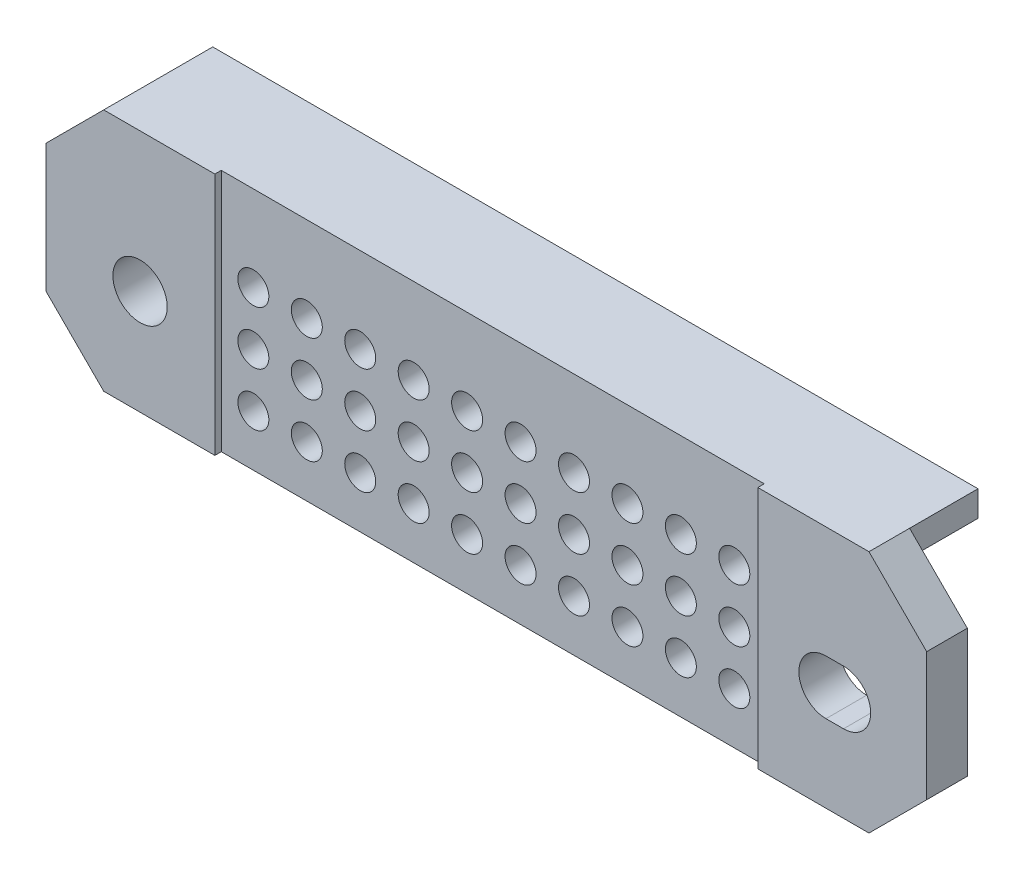
from build123d import *

# Parameters (mm, degrees)
BOSS_EXTRUDE1_DEPTH = 2.032
BOSS_EXTRUDE2_DEPTH = 0.381
SKETCH3_W           = 45.466
SKETCH3_H           = 1.524
BOSS_EXTRUDE3_DEPTH = 4.064
SKETCH4_R           = 1.6129
SKETCH4_R_2         = 0.92075
CUT_EXTRUDE1_DEPTH  = 55.441983395


with BuildPart() as part:
    # Sketch1 → Boss-Extrude1 (new body)
    with BuildSketch(Plane.XY):
        Polygon((0, 3.429), (0, 11.049), (3.429, 14.478), (48.895, 14.478), (52.324, 11.049), (52.324, 3.429), (48.895, 0), (3.429, 0), align=None)
    extrude(amount=BOSS_EXTRUDE1_DEPTH)

    # Sketch2 → Boss-Extrude2 (add)
    with BuildSketch(Plane.XY.offset(2.032)):
        Polygon((0, 11.049), (0, 3.429), (3.429, 0), (10.033, 0), (10.033, 14.478), (3.429, 14.478), align=None)
        Polygon((42.291, 14.478), (42.291, 0), (48.895, 0), (52.324, 3.429), (52.324, 11.049), (48.895, 14.478), align=None)
    extrude(amount=BOSS_EXTRUDE2_DEPTH)

    # Sketch3 → Boss-Extrude3 (add)
    with BuildSketch(Plane(origin=(0, 0, 0), x_dir=(-1, 0, 0), z_dir=(0, 0, -1))):
        with Locations((-26.162, 13.716)):
            Rectangle(SKETCH3_W, SKETCH3_H)
    extrude(amount=BOSS_EXTRUDE3_DEPTH)

    # Sketch4 → Cut-Extrude1 (cut, through all)
    with BuildSketch(Plane(origin=(0, 0, 0), x_dir=(-1, 0, 0), z_dir=(0, 0, -1))):
        with Locations((-5.588, 6.223)):
            Circle(SKETCH4_R)
        with Locations((-11.938, 3.048)):
            Circle(SKETCH4_R_2)
        with Locations((-15.113, 3.048)):
            Circle(SKETCH4_R_2)
        with Locations((-18.288, 3.048)):
            Circle(SKETCH4_R_2)
        with Locations((-21.463, 3.048)):
            Circle(SKETCH4_R_2)
        with Locations((-24.638, 3.048)):
            Circle(SKETCH4_R_2)
        with Locations((-27.813, 3.048)):
            Circle(SKETCH4_R_2)
        with Locations((-30.988, 3.048)):
            Circle(SKETCH4_R_2)
        with Locations((-34.163, 3.048)):
            Circle(SKETCH4_R_2)
        with Locations((-37.338, 3.048)):
            Circle(SKETCH4_R_2)
        with Locations((-40.513, 3.048)):
            Circle(SKETCH4_R_2)
        with Locations((-15.113, 6.223)):
            Circle(SKETCH4_R_2)
        with Locations((-18.288, 6.223)):
            Circle(SKETCH4_R_2)
        with Locations((-21.463, 6.223)):
            Circle(SKETCH4_R_2)
        with Locations((-24.638, 6.223)):
            Circle(SKETCH4_R_2)
        with Locations((-27.813, 6.223)):
            Circle(SKETCH4_R_2)
        with Locations((-30.988, 6.223)):
            Circle(SKETCH4_R_2)
        with Locations((-34.163, 6.223)):
            Circle(SKETCH4_R_2)
        with Locations((-37.338, 6.223)):
            Circle(SKETCH4_R_2)
        with Locations((-40.513, 6.223)):
            Circle(SKETCH4_R_2)
        with Locations((-15.113, 9.398)):
            Circle(SKETCH4_R_2)
        with Locations((-18.288, 9.398)):
            Circle(SKETCH4_R_2)
        with Locations((-21.463, 9.398)):
            Circle(SKETCH4_R_2)
        with Locations((-24.638, 9.398)):
            Circle(SKETCH4_R_2)
        with Locations((-27.813, 9.398)):
            Circle(SKETCH4_R_2)
        with Locations((-30.988, 9.398)):
            Circle(SKETCH4_R_2)
        with Locations((-34.163, 9.398)):
            Circle(SKETCH4_R_2)
        with Locations((-37.338, 9.398)):
            Circle(SKETCH4_R_2)
        with Locations((-40.513, 9.398)):
            Circle(SKETCH4_R_2)
        with Locations((-11.938, 6.223)):
            Circle(SKETCH4_R_2)
        with Locations((-11.938, 9.398)):
            Circle(SKETCH4_R_2)
        with BuildLine():
            Line((-47.3837, 7.8359), (-46.3423, 7.8359))
            ThreePointArc((-46.3423, 7.8359), (-44.7294, 6.223), (-46.3423, 4.6101))
            Line((-46.3423, 4.6101), (-47.3837, 4.6101))
            ThreePointArc((-47.3837, 4.6101), (-48.9966, 6.223), (-47.3837, 7.8359))
        make_face()
    extrude(amount=-CUT_EXTRUDE1_DEPTH, mode=Mode.SUBTRACT)


solid = part.part
